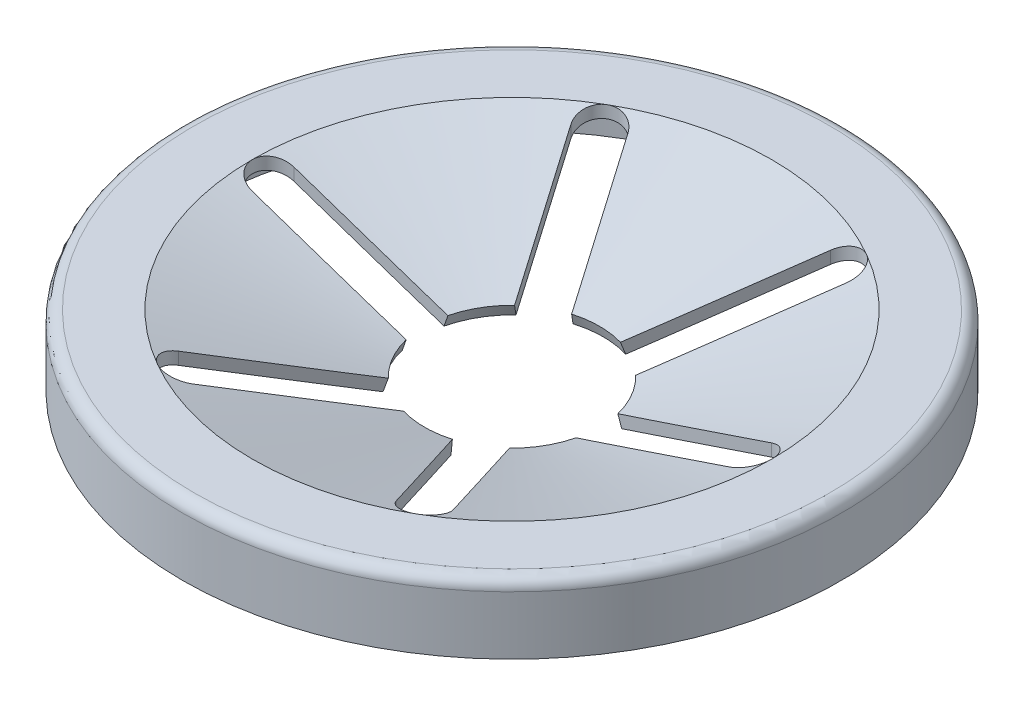
from build123d import *

# Parameters (mm, degrees)
CUT_SLIT_DEPTH         = 9.079913366
PATTERN_CUT_SLIT_COUNT = 6


with BuildPart() as part:
    # Sketch4 → Body-Washer (revolve)
    with BuildSketch(Plane.XY, mode=Mode.PRIVATE) as body_washer_sk:
        with BuildLine():
            Line((1.5, 0.2), (4.45, 1.2))
            Line((4.45, 1.2), (5.45, 1.2))
            ThreePointArc((5.45, 1.2), (5.591421356, 1.141421356), (5.65, 1))
            Line((5.65, 1), (5.65, 0))
            Line((5.65, 0), (5.45, 0))
            Line((5.45, 0), (5.45, 1))
            Line((5.45, 1), (4.482976725, 1))
            Line((4.482976725, 1), (1.564207856, 0.010586824))
            Line((1.564207856, 0.010586824), (1.5, 0.2))
        make_face()
    revolve(body_washer_sk.sketch.rotate(Axis((0, 1.2, 0), (0, -1, 0)), 90), axis=Axis((0, 1.2, 0), (0, -1, 0)))

    # Sketch5 → Cut-Slit (cut, through all)
    with BuildSketch(Plane(origin=(0, 0, 0), x_dir=(1, 0, 0), z_dir=(0, 1, 0))):
        with BuildLine():
            Line((4.091996679, 0.358003321), (1.45665151, 0.358003321))
            ThreePointArc((1.45665151, 0.358003321), (1.5, 0), (1.45665151, -0.358003321))
            Line((1.45665151, -0.358003321), (4.091996679, -0.358003321))
            ThreePointArc((4.091996679, -0.358003321), (4.45, 0), (4.091996679, 0.358003321))
        make_face()
    cut_slit = extrude(amount=CUT_SLIT_DEPTH, mode=Mode.SUBTRACT)

    # Pattern-Cut-Slit: Cut-Slit ×6 about axis
    pattern_cut_slit_axis = Axis((0, 0, 0), (0, 1, 0))
    for i in range(1, PATTERN_CUT_SLIT_COUNT):
        add(cut_slit.rotate(pattern_cut_slit_axis, i * 360 / PATTERN_CUT_SLIT_COUNT), mode=Mode.SUBTRACT)


solid = part.part
